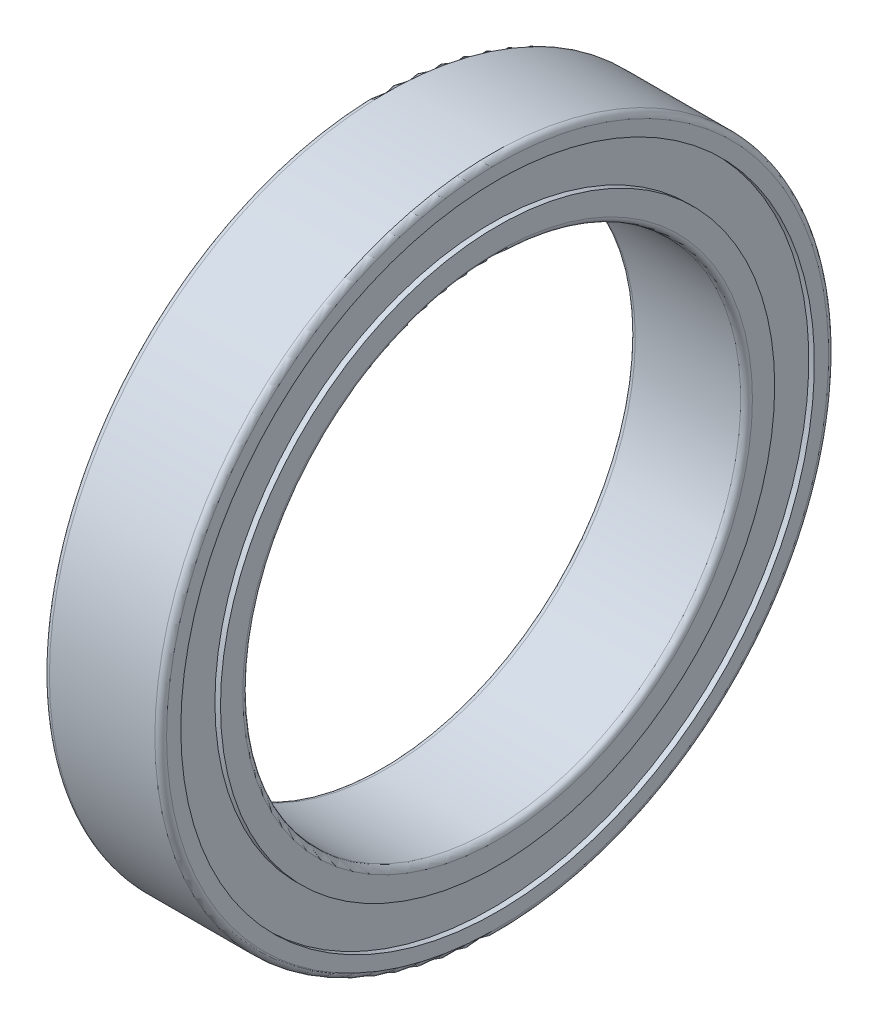
from build123d import *

# Parameters (mm, degrees)
FILLET1_R = 0.2
FILLET2_R = 0.2


with BuildPart() as part:
    # Sketch1 → Revolve1 (revolve)
    with BuildSketch(Plane.XY, mode=Mode.PRIVATE) as revolve1_sk:
        Polygon((0, 8.5), (4, 8.5), (4, 9.46), (3.81, 9.46), (3.81, 10.815), (4, 10.815), (4, 11.5), (0, 11.5), (0, 10.815), (0.19, 10.815), (0.19, 9.46), (0, 9.46), align=None)
    revolve(revolve1_sk.sketch.rotate(Axis((0, 0, 0), (1, 0, 0)), 90), axis=Axis((0, 0, 0), (1, 0, 0)))

    # Fillet1
    fillet1_edges = [part.edges().sort_by_distance(p)[0] for p in [
        (0, 0, -11.5),
        (4, 0, -11.5),
    ]]
    fillet(fillet1_edges, radius=FILLET1_R)

    # Fillet2
    fillet2_edges = [part.edges().sort_by_distance(p)[0] for p in [
        (4, 0, -8.5),
        (0, 0, -8.5),
    ]]
    fillet(fillet2_edges, radius=FILLET2_R)


solid = part.part
